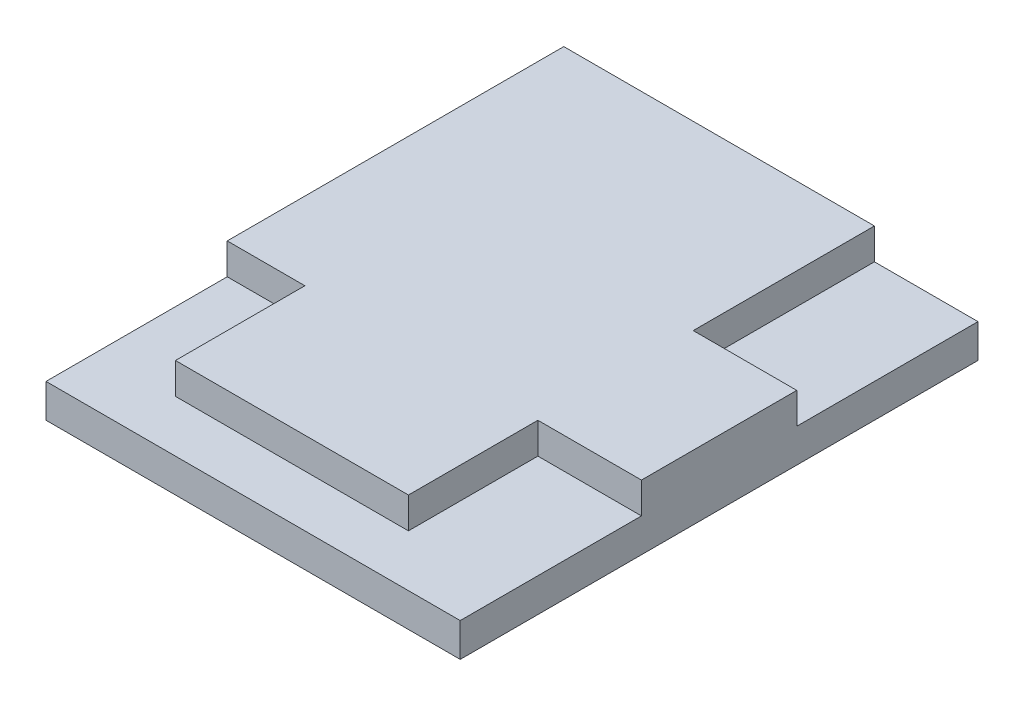
from build123d import *

# Parameters (mm, degrees)
SKETCH1_W           = 16
SKETCH1_H           = 20
BOSS_EXTRUDE1_DEPTH = 1.3
BOSS_EXTRUDE2_DEPTH = 1.2


with BuildPart() as part:
    # Sketch1 → Boss-Extrude1 (new body)
    with BuildSketch(Plane(origin=(0, 0, 0), x_dir=(1, 0, 0), z_dir=(0, 1, 0))):
        with Locations((8, 10)):
            Rectangle(SKETCH1_W, SKETCH1_H)
    extrude(amount=BOSS_EXTRUDE1_DEPTH)

    # Sketch2 → Boss-Extrude2 (add)
    with BuildSketch(Plane(origin=(0, 1.3, 0), x_dir=(1, 0, 0), z_dir=(0, 1, 0))):
        Polygon((3, 7), (3, 2), (12, 2), (12, 7), (16, 7), (16, 13), (12, 13), (12, 20), (0, 20), (0, 7), align=None)
    extrude(amount=BOSS_EXTRUDE2_DEPTH)


solid = part.part
